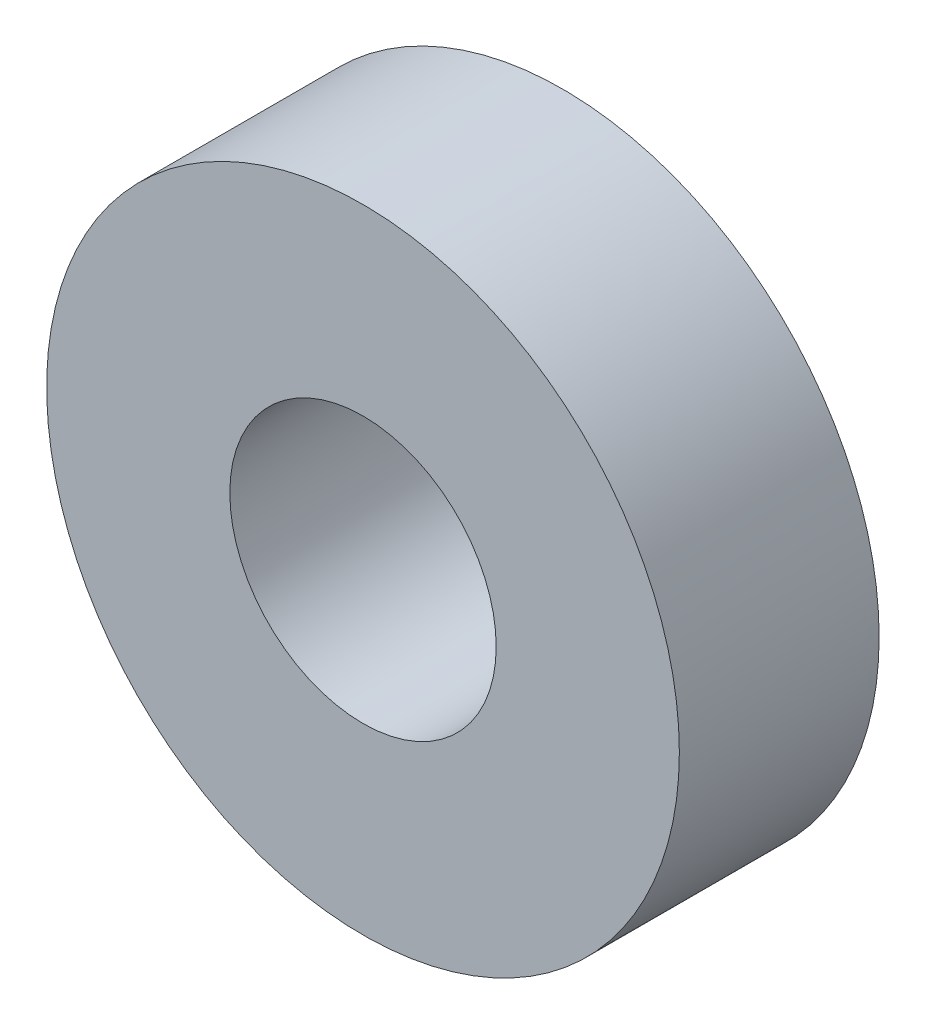
from build123d import *

# Parameters (mm, degrees)
MODEL_R                 = 4.75
MODEL_R_2               = 2
SALIENTE_EXTRUIR1_DEPTH = 3


with BuildPart() as part:
    # Model → Saliente-Extruir1 (new body)
    with BuildSketch(Plane.XY):
        with Locations((13.813781479, 292.251403298)):
            Circle(MODEL_R)
        with Locations((13.813781479, 292.251403298)):
            Circle(MODEL_R_2, mode=Mode.SUBTRACT)
    extrude(amount=SALIENTE_EXTRUIR1_DEPTH)


solid = part.part
